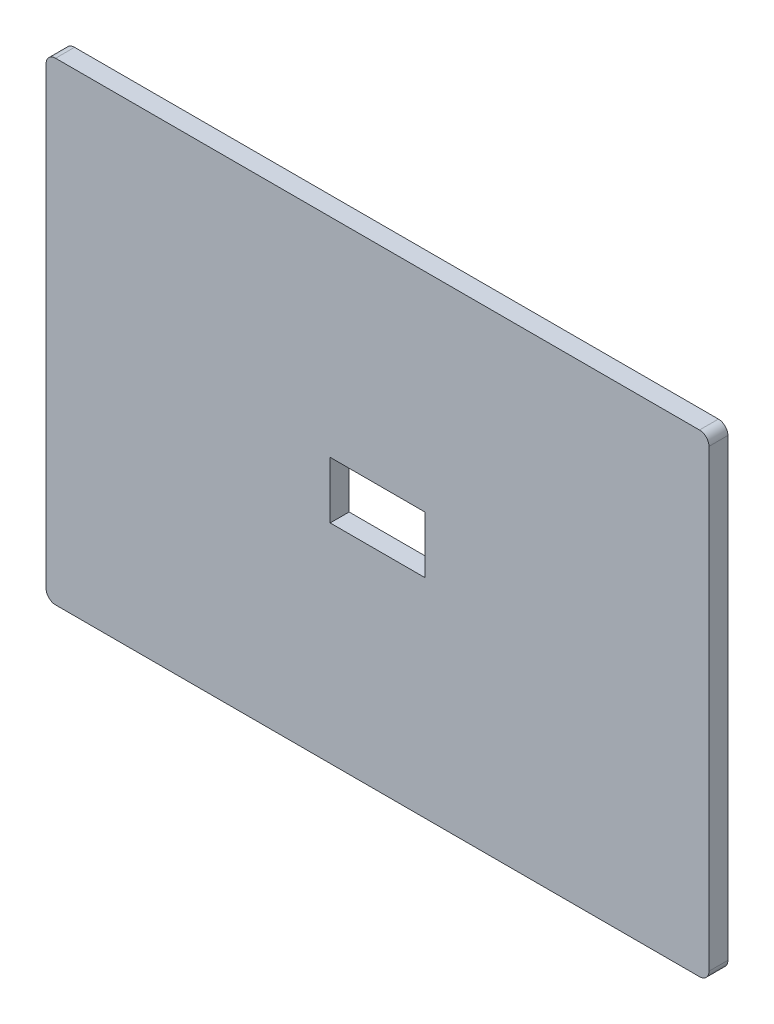
from build123d import *

# Parameters (mm, degrees)
SKIZZE1_W                       = 350
SKIZZE1_H                       = 250
AUFSATZ_LINEAR_AUSTRAGEN1_DEPTH = 10
VERRUNDUNG1_R                   = 5
SKIZZE3_W                       = 50
SKIZZE3_H                       = 30
SCHNITT_LINEAR_AUSTRAGEN1_DEPTH = 216.290501416


with BuildPart() as part:
    # Skizze1 → Aufsatz-Linear austragen1 (new body)
    with BuildSketch(Plane.XY):
        Rectangle(SKIZZE1_W, SKIZZE1_H)
    extrude(amount=AUFSATZ_LINEAR_AUSTRAGEN1_DEPTH)

    # Verrundung1
    verrundung1_edges = [part.edges().sort_by_distance(p)[0] for p in [
        (-175, 125, 5),
        (175, 125, 5),
        (175, -125, 5),
        (-175, -125, 5),
    ]]
    fillet(verrundung1_edges, radius=VERRUNDUNG1_R)

    # Skizze3 → Schnitt-Linear austragen1 (cut, through all)
    with BuildSketch(Plane.XY.offset(10)):
        Rectangle(SKIZZE3_W, SKIZZE3_H)
    extrude(amount=-SCHNITT_LINEAR_AUSTRAGEN1_DEPTH, mode=Mode.SUBTRACT)


solid = part.part
